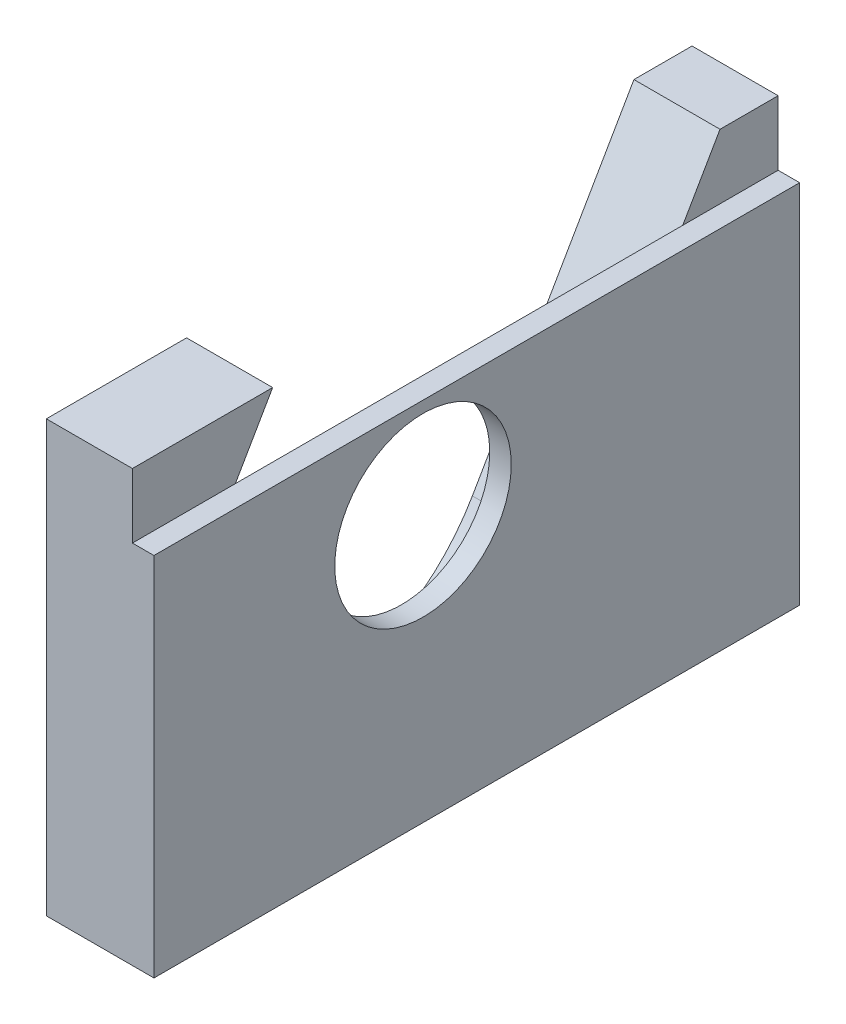
from build123d import *

# Parameters (mm, degrees)
SKETCH1_W           = 30
SKETCH1_H           = 20
BOSS_EXTRUDE1_DEPTH = 4
CUT_EXTRUDE1_DEPTH  = 37.276714294
SKETCH3_W           = 30
SKETCH3_H           = 17
BOSS_EXTRUDE2_DEPTH = 1
SKETCH4_R           = 4.1
CUT_EXTRUDE2_DEPTH  = 37.400549446


with BuildPart() as part:
    # Sketch1 → Boss-Extrude1 (new body)
    with BuildSketch(Plane(origin=(0, 0, 0), x_dir=(0, 0, -1), z_dir=(1, 0, 0))):
        with Locations((15, 10)):
            Rectangle(SKETCH1_W, SKETCH1_H)
    extrude(amount=BOSS_EXTRUDE1_DEPTH)

    # Sketch2 → Cut-Extrude1 (cut, through all)
    with BuildSketch(Plane(origin=(4, 0, 0), x_dir=(0, 0, -1), z_dir=(1, 0, 0))):
        with BuildLine():
            Line((4.205771366, 16), (19.205771366, 41.980762114))
            Line((19.205771366, 41.980762114), (34.794228634, 32.980762114))
            Line((34.794228634, 32.980762114), (19.794228634, 7))
            ThreePointArc((19.794228634, 7), (7.5, 3.705771366), (4.205771366, 16))
        make_face()
    extrude(amount=-CUT_EXTRUDE1_DEPTH, mode=Mode.SUBTRACT)

    # Sketch3 → Boss-Extrude2 (add)
    with BuildSketch(Plane(origin=(4, 0, 0), x_dir=(0, 0, -1), z_dir=(1, 0, 0))):
        with Locations((15, 8.5)):
            Rectangle(SKETCH3_W, SKETCH3_H)
    extrude(amount=BOSS_EXTRUDE2_DEPTH)

    # Sketch4 → Cut-Extrude2 (cut, through all)
    with BuildSketch(Plane(origin=(5, 0, 0), x_dir=(0, 0, -1), z_dir=(1, 0, 0))):
        with Locations((12.5, 12.366025404)):
            Circle(SKETCH4_R)
    extrude(amount=-CUT_EXTRUDE2_DEPTH, mode=Mode.SUBTRACT)


solid = part.part
